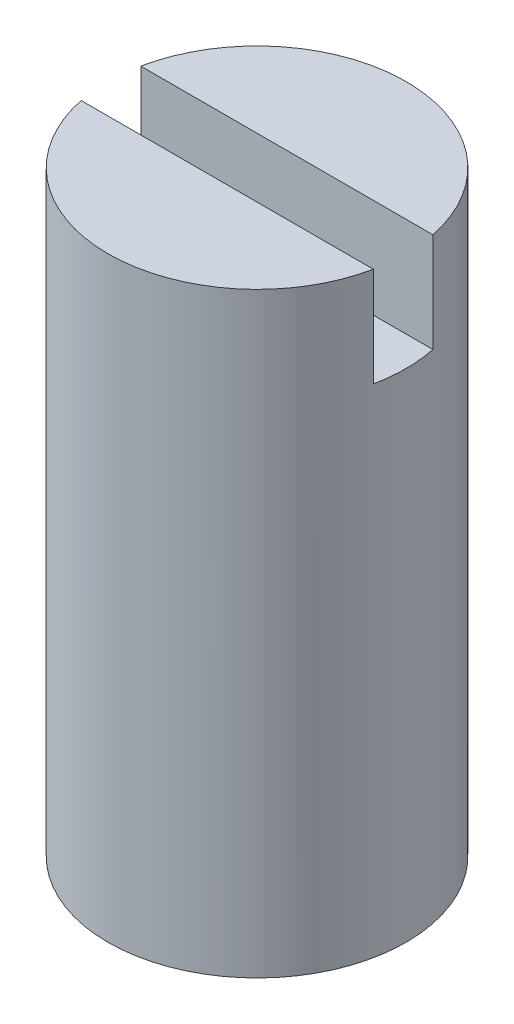
from build123d import *

# Parameters (mm, degrees)
SKETCH1_R           = 4.7625
BOSS_EXTRUDE1_DEPTH = 19.05
SKETCH2_W           = 9.525
SKETCH2_H           = 1.905
CUT_EXTRUDE1_DEPTH  = 3.175
SKETCH3_R           = 2
CUT_EXTRUDE2_DEPTH  = 8


with BuildPart() as part:
    # Sketch1 → Boss-Extrude1 (new body)
    with BuildSketch(Plane(origin=(0, 0, 0), x_dir=(1, 0, 0), z_dir=(0, 1, 0))):
        with Locations(Location((0, 0, 0), (0, 0, 270))):
            Circle(SKETCH1_R)
    extrude(amount=-BOSS_EXTRUDE1_DEPTH)

    # Sketch2 → Cut-Extrude1 (cut)
    with BuildSketch(Plane(origin=(0, 0, 0), x_dir=(1, 0, 0), z_dir=(0, 1, 0))):
        Rectangle(SKETCH2_W, SKETCH2_H)
    extrude(amount=-CUT_EXTRUDE1_DEPTH, mode=Mode.SUBTRACT)

    # Sketch3 → Cut-Extrude2 (cut)
    with BuildSketch(Plane.XZ.offset(19.05)):
        with Locations(Location((0, 0, 0), (0, 0, 270))):
            Circle(SKETCH3_R)
    extrude(amount=-CUT_EXTRUDE2_DEPTH, mode=Mode.SUBTRACT)


solid = part.part
